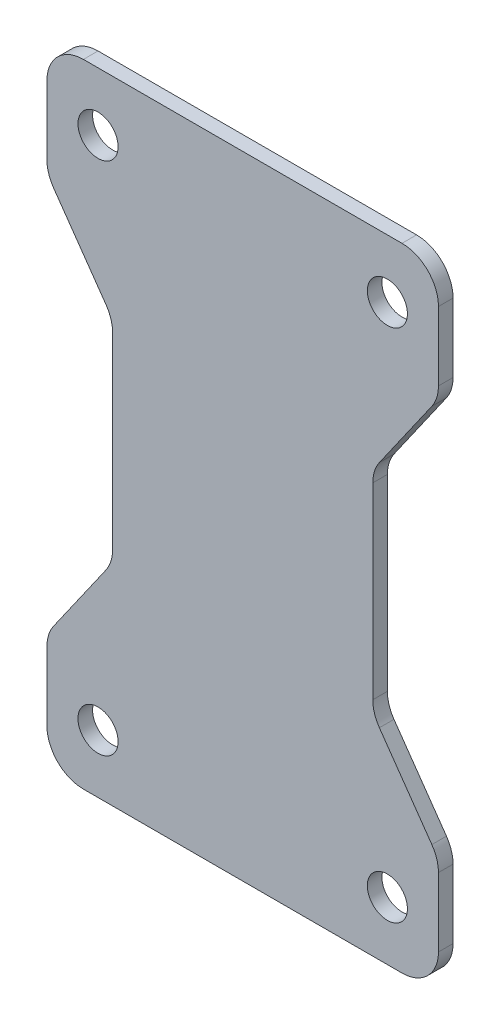
from build123d import *

# Parameters (mm, degrees)
SKETCH12_W                     = 4.57134
SKETCH12_H                     = 203.2
BOSS_EXTRUDE1_START            = -173.2
BOSS_EXTRUDE1_DEPTH            = 173.2
BOSS_EXTRUDE2_DEPTH            = 4
SKETCH29_W                     = 5.5
SKETCH29_H                     = 4
M10_CLEARANCE_HOLE1_AT_2_COUNT = 2
M10_CLEARANCE_HOLE1_AT_2_PITCH = 141.2
FILLET1_R                      = 10
MIRROR1_COPY_1_SKETCH_W        = 5.5
MIRROR1_COPY_1_SKETCH_H        = 4
FILLET1_OF_MIRROR1_R           = 10


with BuildPart() as part:
    # Sketch12 → Revolve1 (revolve)
    with BuildSketch(Plane.XY, mode=Mode.PRIVATE) as revolve1_sk:
        with Locations((-23.36433, 101.6)):
            Rectangle(SKETCH12_W, SKETCH12_H)
    revolve(revolve1_sk.sketch.rotate(Axis((0, 0, 0), (0, 1, 0)), 270), axis=Axis((0, 0, 0), (0, 1, 0)))

    # Sketch14 → Boss-Extrude1 (add)
    with BuildSketch(Plane(origin=(0, 30, 0), x_dir=(-1, 0, 0), z_dir=(0, -1, 0)).offset(BOSS_EXTRUDE1_START)):
        with BuildLine():
            Line((-25.65, 0), (-25.65, -25.65))
            Line((-25.65, -25.65), (1.5e-08, -25.65))
            ThreePointArc((1.5e-08, -25.65), (-18.137288932, -18.137288943), (-25.65, 0))
        make_face()
        with BuildLine():
            ThreePointArc((25.65, 0), (18.137288943, -18.137288932), (1.5e-08, -25.65))
            Line((1.5e-08, -25.65), (25.65, -25.65))
            Line((25.65, -25.65), (25.65, 0))
        make_face()
    extrude(amount=BOSS_EXTRUDE1_DEPTH)


with BuildPart() as body_2:
    # Sketch27 → Boss-Extrude2 (new body)
    with BuildSketch(Plane.XY.offset(25.65)):
        Polygon((53.65, 203.2), (-25.65, 203.2), (-25.65, 30), (53.65, 30), (53.65, 62), (35.65, 87.706664121), (35.65, 145.493335879), (53.65, 171.2), align=None)
    boss_extrude2 = extrude(amount=BOSS_EXTRUDE2_DEPTH)

    # Sketch29 → M10 Clearance Hole1 (revolve, cut)
    with BuildSketch(Plane(origin=(39.65, 46, 25.65), x_dir=(0, 1, 0), z_dir=(1, 0, 0))):
        with Locations((2.75, 2)):
            Rectangle(SKETCH29_W, SKETCH29_H)
    m10_clearance_hole1 = revolve(axis=Axis((39.65, 46, 19.3), (0, 0, 1)), mode=Mode.SUBTRACT)

    # M10 Clearance Hole1 at 2: M10 Clearance Hole1 ×2
    with Locations(*[(0, i * M10_CLEARANCE_HOLE1_AT_2_PITCH, 0) for i in range(1, M10_CLEARANCE_HOLE1_AT_2_COUNT)]):
        add(m10_clearance_hole1, mode=Mode.SUBTRACT)

    # Fillet1
    fillet1_edges = [body_2.edges().sort_by_distance(p)[0] for p in [
        (53.65, 203.2, 27.65),
        (53.65, 171.2, 27.65),
        (35.65, 145.493335879, 27.65),
        (35.65, 87.706664121, 27.65),
        (53.65, 62, 27.65),
        (53.65, 30, 27.65),
    ]]
    fillet(fillet1_edges, radius=FILLET1_R)

    # Mirror1: Boss-Extrude2, M10 Clearance Hole1 across plane
    add(boss_extrude2.mirror(Plane(origin=(0, 0, 0), x_dir=(0, 0, 1), z_dir=(1, 0, 0))))
    add(m10_clearance_hole1.mirror(Plane(origin=(0, 0, 0), x_dir=(0, 0, 1), z_dir=(1, 0, 0))), mode=Mode.SUBTRACT)

    # Mirror1 copy 1 sketch → Mirror1 copy 1 (revolve, cut)
    with BuildSketch(Plane(origin=(-39.65, 187.2, 25.65), x_dir=(0, 1, 0), z_dir=(-1, 0, 0))):
        with Locations((2.75, -2)):
            Rectangle(MIRROR1_COPY_1_SKETCH_W, MIRROR1_COPY_1_SKETCH_H)
    revolve(axis=Axis((-39.65, 187.2, 19.3), (0, 0, -1)), mode=Mode.SUBTRACT)

    # Fillet1 of Mirror1
    fillet1_of_mirror1_edges = [body_2.edges().sort_by_distance(p)[0] for p in [
        (-53.65, 203.2, 27.65),
        (-53.65, 171.2, 27.65),
        (-35.65, 145.493335879, 27.65),
        (-35.65, 87.706664121, 27.65),
        (-53.65, 62, 27.65),
        (-53.65, 30, 27.65),
    ]]
    fillet(fillet1_of_mirror1_edges, radius=FILLET1_OF_MIRROR1_R)


solid = body_2.part
